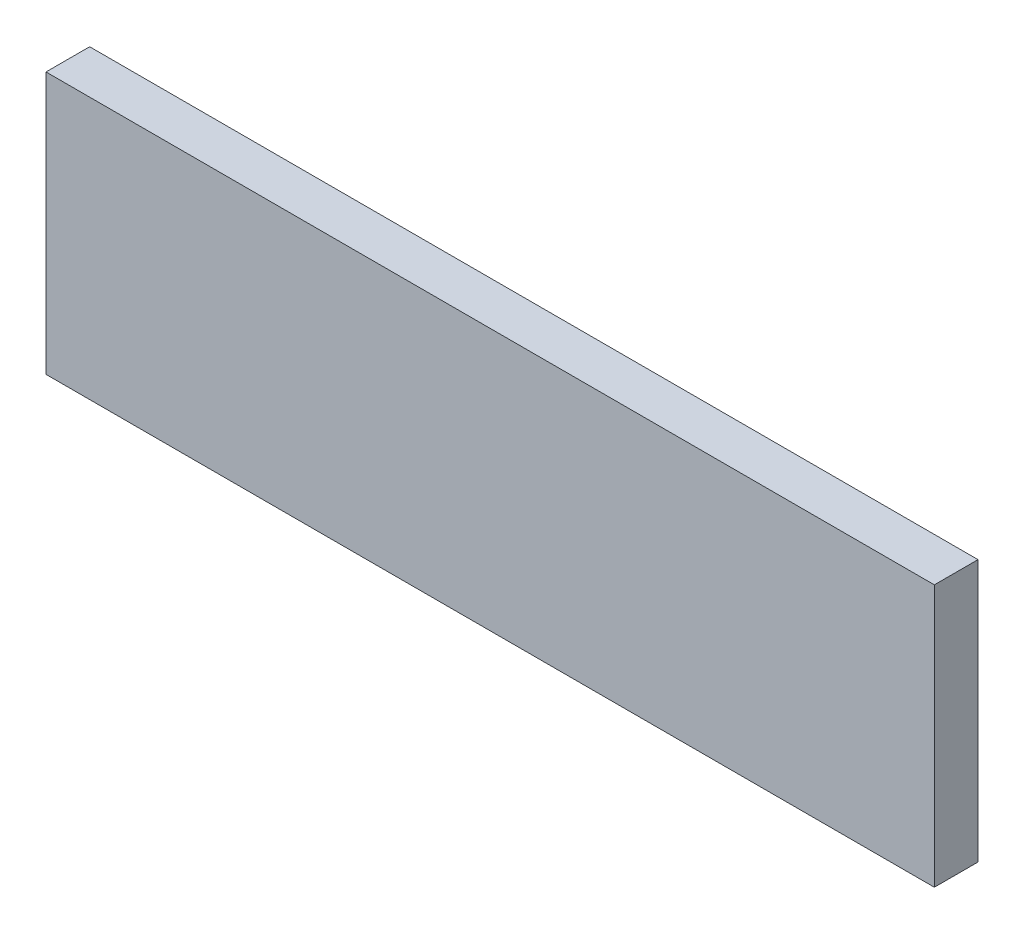
from build123d import *

# Parameters (mm, degrees)
CROQUIS1_W              = 407
CROQUIS1_H              = 120
SALIENTE_EXTRUIR1_DEPTH = 20


with BuildPart() as part:
    # Croquis1 → Saliente-Extruir1 (new body)
    with BuildSketch(Plane.XY):
        Rectangle(CROQUIS1_W, CROQUIS1_H)
    extrude(amount=SALIENTE_EXTRUIR1_DEPTH)


solid = part.part
